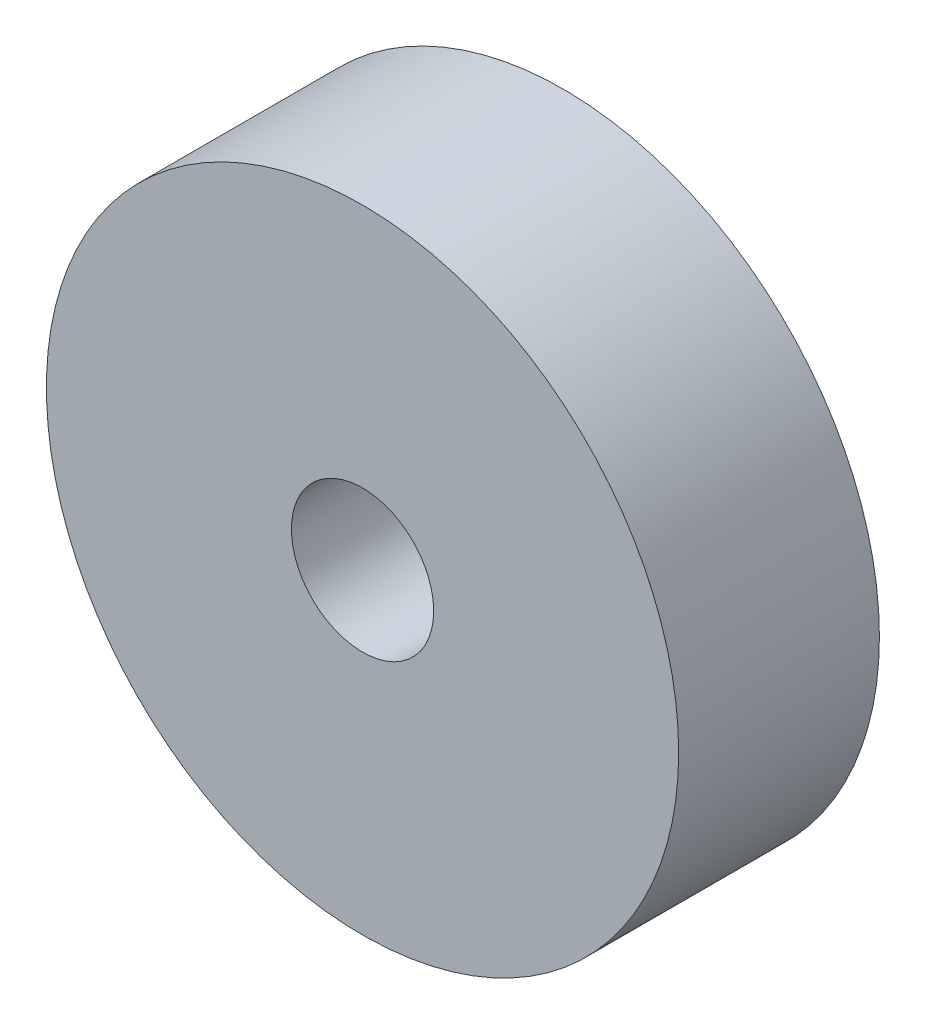
from build123d import *

# Parameters (mm, degrees)
SKETCH1_R           = 10
SKETCH1_R_2         = 2.250000056
BOSS_EXTRUDE1_DEPTH = 6.35


with BuildPart() as part:
    # Sketch1 → Boss-Extrude1 (new body)
    with BuildSketch(Plane.XY):
        Circle(SKETCH1_R)
        Circle(SKETCH1_R_2, mode=Mode.SUBTRACT)
    extrude(amount=BOSS_EXTRUDE1_DEPTH)


solid = part.part
